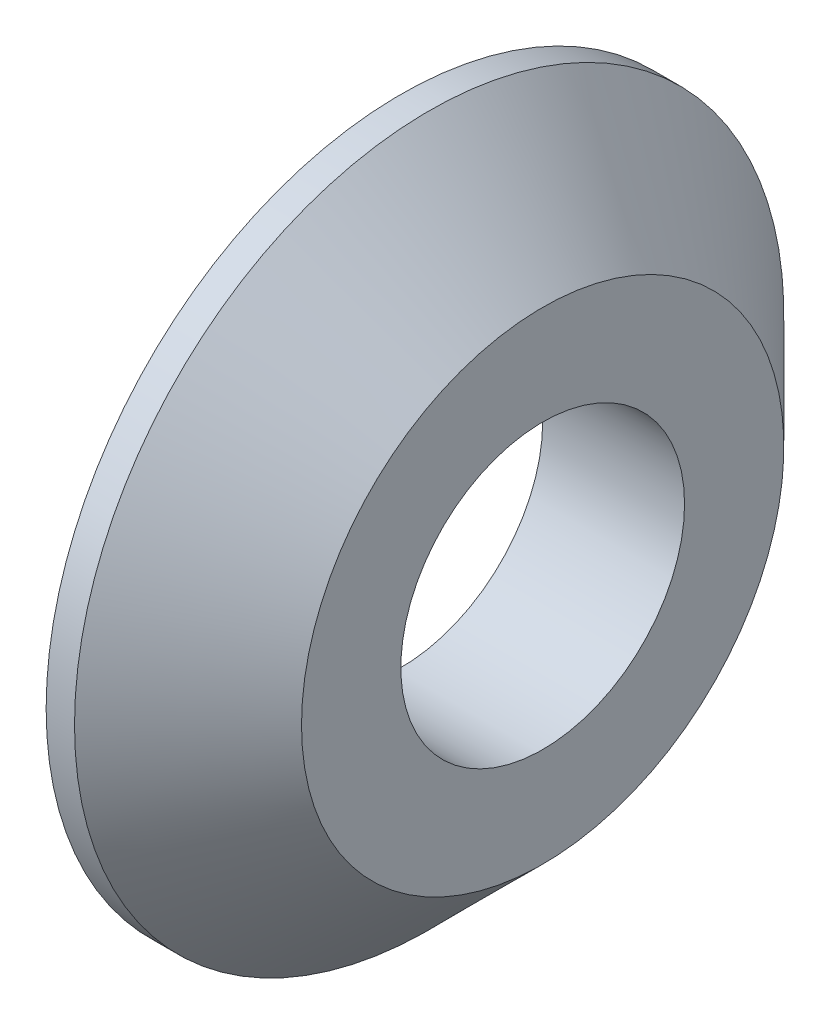
from build123d import *

# Parameters (mm, degrees)
CROQUIS2_R            = 1
CORTAR_EXTRUIR1_DEPTH = 4.674234614


with BuildPart() as part:
    # Croquis1 → Revolución1 (revolve)
    with BuildSketch(Plane.XY, mode=Mode.PRIVATE) as revoluci_n1_sk:
        Polygon((0, 0), (0, 2.5), (0.2, 2.5), (1, 1.7), (1, 0), align=None)
    revolve(revoluci_n1_sk.sketch.rotate(Axis((0, 0, 0), (1, 0, 0)), 90), axis=Axis((0, 0, 0), (1, 0, 0)))

    # Croquis2 → Cortar-Extruir1 (cut, through all)
    with BuildSketch(Plane(origin=(1, 0, 0), x_dir=(0, 0, -1), z_dir=(1, 0, 0))):
        Circle(CROQUIS2_R)
    extrude(amount=-CORTAR_EXTRUIR1_DEPTH, mode=Mode.SUBTRACT)


solid = part.part
